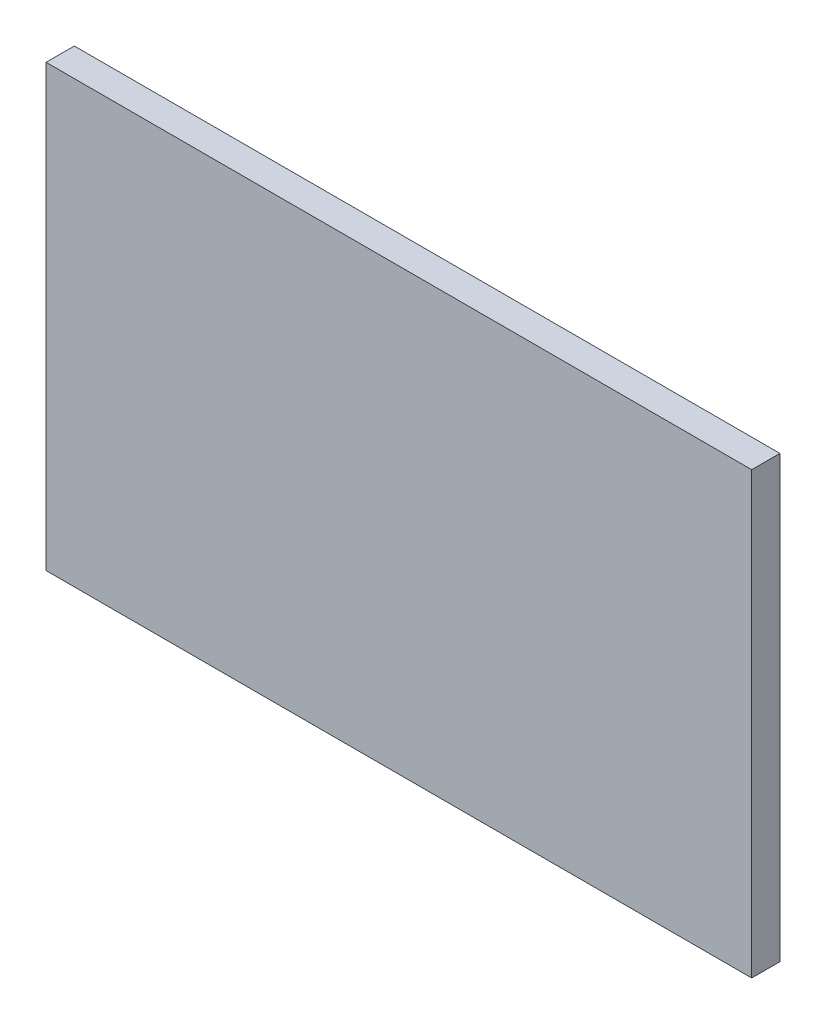
from build123d import *

# Parameters (mm, degrees)
SKETCH1_W           = 100
SKETCH1_H           = 62.385378537
BOSS_EXTRUDE1_DEPTH = 4


with BuildPart() as part:
    # Sketch1 → Boss-Extrude1 (new body)
    with BuildSketch(Plane.XY.offset(110.516306216)):
        with Locations((52.939176668, 42.023959891)):
            Rectangle(SKETCH1_W, SKETCH1_H)
    extrude(amount=BOSS_EXTRUDE1_DEPTH)


solid = part.part
